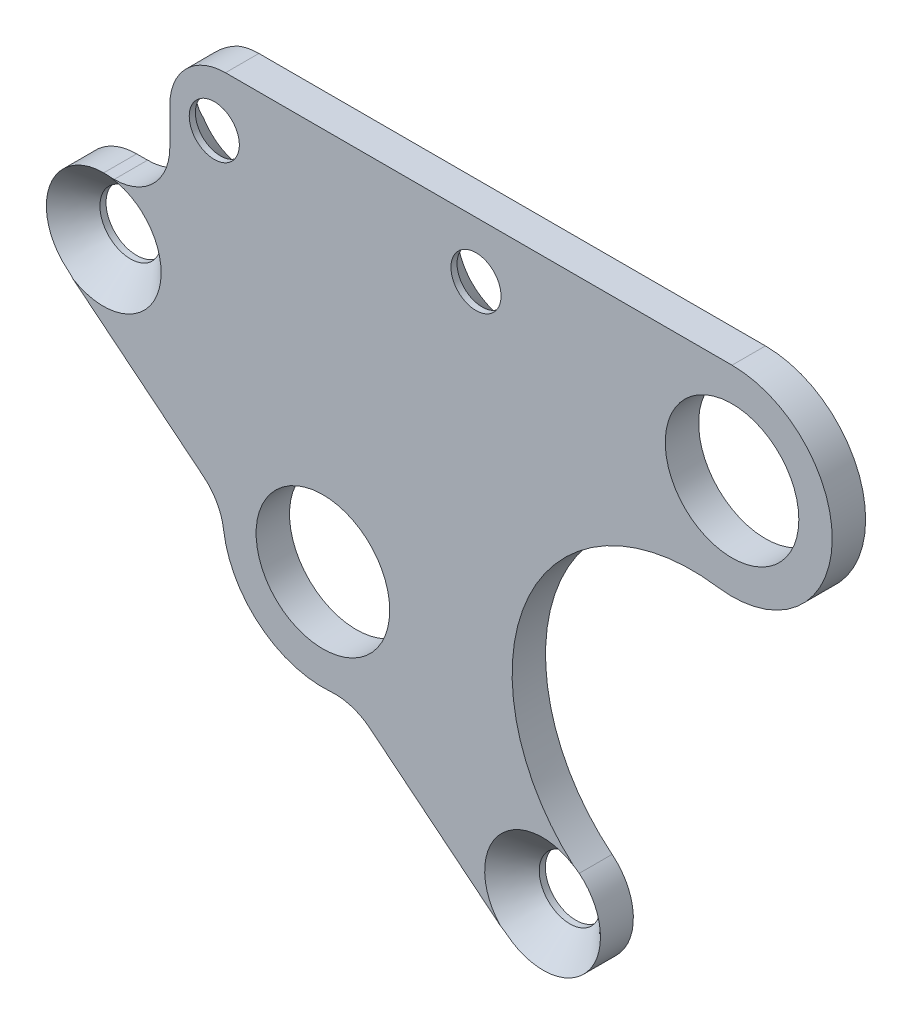
from build123d import *

# Parameters (mm, degrees)
SKETCH1_R                                    = 2
SKETCH1_R_2                                  = 6
BOSS_EXTRUDE1_DEPTH                          = 3
FILLET1_R                                    = 5
CSK_FOR_M4_COUNTERSUNK_FLAT_HEAD_SCR_2_COUNT = 2
CSK_FOR_M4_COUNTERSUNK_FLAT_HEAD_SCR_2_PITCH = 23.508708273
CSK_FOR_M5_COUNTERSUNK_FLAT_HEAD_SCR_2_COUNT = 2
CSK_FOR_M5_COUNTERSUNK_FLAT_HEAD_SCR_2_PITCH = 50.8


with BuildPart() as part:
    # Sketch1 → Boss-Extrude1 (new body)
    with BuildSketch(Plane.XY):
        with BuildLine():
            Line((16.48489132, -19.999559574), (2.484638151, -8.650235445))
            ThreePointArc((2.484638151, -8.650235445), (-5.667544957, -6.991347092), (-8.977125763, 0.641258943))
            Line((-8.977125763, 0.641258943), (-22.977378932, 11.990583072))
            ThreePointArc((-22.977378932, 11.990583072), (-24.590001349, 17.71711779), (-19.731135126, 21.150071323))
            Line((-19.731135126, 21.150071323), (-14.065364661, 21.150071323))
            Line((-14.065364661, 21.150071323), (-13.75, 21.150071323))
            Line((-13.75, 21.150071323), (-13.75, 34.45))
            Line((-13.75, 34.45), (13.75, 34.45))
            Line((13.75, 34.45), (36.75, 34.45))
            ThreePointArc((36.75, 34.45), (45.726790692, 24.804067443), (35.461466363, 16.542717526))
            ThreePointArc((35.461466363, 16.542717526), (18.351015207, 7.031288175), (22.977378932, -11.990583072))
            ThreePointArc((22.977378932, -11.990583072), (23.735623377, -19.241315129), (16.48489132, -19.999559574))
        make_face()
        with Locations((-19.731135126, 15.995071323)):
            Circle(SKETCH1_R, mode=Mode.SUBTRACT)
        with Locations((19.731135126, -15.995071323)):
            Circle(SKETCH1_R, mode=Mode.SUBTRACT)
        Circle(SKETCH1_R_2, mode=Mode.SUBTRACT)
        with Locations((36.75, 25.45)):
            Circle(SKETCH1_R_2, mode=Mode.SUBTRACT)
    extrude(amount=BOSS_EXTRUDE1_DEPTH)

    # Fillet1
    fillet1_edges = [part.edges().sort_by_distance(p)[0] for p in [
        (2.484638151, -8.650235445, 1.5),
        (-8.977125763, 0.641258943, 1.5),
        (-13.75, 21.150071323, 1.5),
        (-13.75, 34.45, 1.5),
    ]]
    fillet(fillet1_edges, radius=FILLET1_R)

    # Sketch3 → CSK for M4 Countersunk Flat Head Screw1 (revolve, cut)
    with BuildSketch(Plane(origin=(13.75, 29.45, 0), x_dir=(0, 1, 0), z_dir=(1, 0, 0))):
        Polygon((0, 0), (0, 3), (2.25, 3), (2.25, 2.45), (4.7, 0), align=None)
    csk_for_m4_countersunk_flat_head_screw1 = revolve(axis=Axis((13.75, 29.45, -6.35), (0, 0, 1)), mode=Mode.SUBTRACT)

    # CSK for M4 Countersunk Flat Head Scr 2: CSK for M4 Countersunk Flat Head Screw1 ×2
    with Locations(*[(-i * CSK_FOR_M4_COUNTERSUNK_FLAT_HEAD_SCR_2_PITCH, 0, 0) for i in range(1, CSK_FOR_M4_COUNTERSUNK_FLAT_HEAD_SCR_2_COUNT)]):
        add(csk_for_m4_countersunk_flat_head_screw1, mode=Mode.SUBTRACT)

    # Sketch6 → CSK for M5 Countersunk Flat Head Screw1 (revolve, cut)
    with BuildSketch(Plane(origin=(-19.731135126, 15.995071323, 3), x_dir=(0, -1, 0), z_dir=(1, 0, 0))):
        Polygon((0, 0), (0, 3), (2.75, 3), (2.75, 2.45), (5.2, 0), align=None)
    csk_for_m5_countersunk_flat_head_screw1 = revolve(axis=Axis((-19.731135126, 15.995071323, 9.35), (0, 0, -1)), mode=Mode.SUBTRACT)

    # CSK for M5 Countersunk Flat Head Scr 2: CSK for M5 Countersunk Flat Head Screw1 ×2
    with Locations(*[Vector(0.7768163435563247, -0.6297272174392513, 0) * (i * CSK_FOR_M5_COUNTERSUNK_FLAT_HEAD_SCR_2_PITCH) for i in range(1, CSK_FOR_M5_COUNTERSUNK_FLAT_HEAD_SCR_2_COUNT)]):
        add(csk_for_m5_countersunk_flat_head_screw1, mode=Mode.SUBTRACT)


solid = part.part
